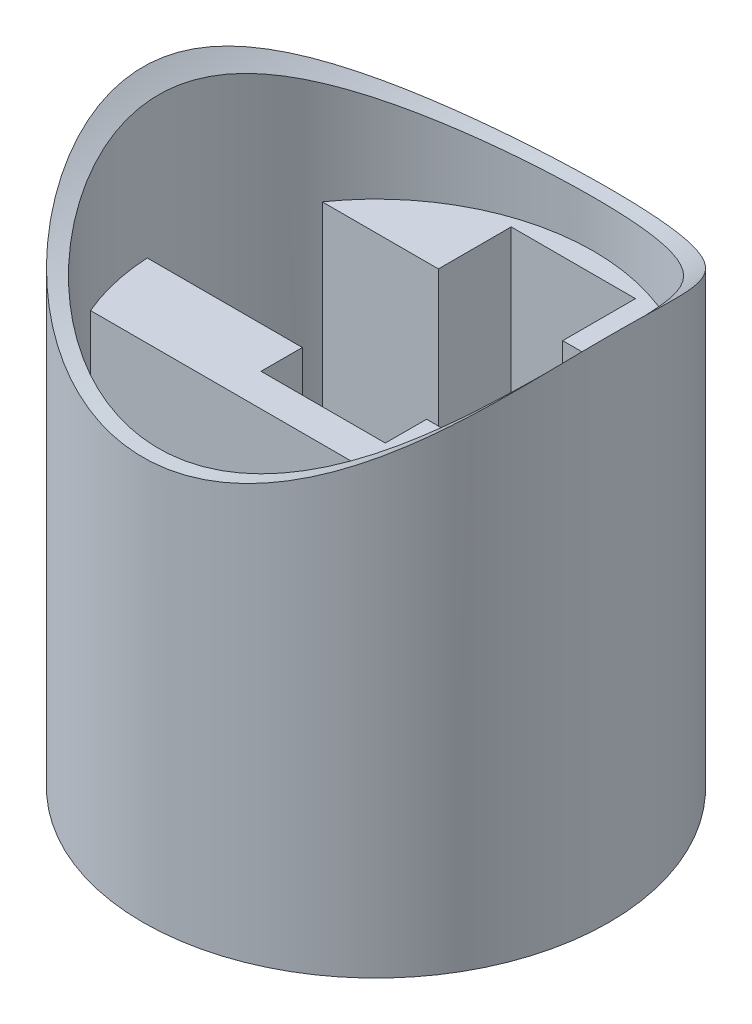
from build123d import *

# Parameters (mm, degrees)
SKETCH2_R               = 37.5
SKETCH2_R_2             = 35
BOSS_EXTRUDE2_DEPTH     = 37.3
BOSS_EXTRUDE3_START     = 20
SKETCH3_R               = 37.5
BOSS_EXTRUDE3_DEPTH     = 20
SKETCH4_R               = 37.5
SKETCH4_R_2             = 35
BOSS_EXTRUDE4_DEPTH     = 40
CUT_EXTRUDE2_DEPTH      = 60
CUT_EXTRUDE2_DEPTH_BACK = 60
SKETCH5_R               = 50


with BuildPart() as part:
    # Sketch2 → Boss-Extrude2 (new body)
    # profile 1 of 3: a face of its own
    with BuildSketch(Plane(origin=(0, 0, 0), x_dir=(1, 0, 0), z_dir=(0, 1, 0))):
        with Locations(Location((0, 0, 0), (0, 0, 270))):
            Circle(SKETCH2_R)
        Circle(SKETCH2_R_2, mode=Mode.SUBTRACT)
    # profile 2 of 3: a face of its own
    with BuildSketch(Plane(origin=(0, 0, 0), x_dir=(1, 0, 0), z_dir=(0, 1, 0))):
        with BuildLine():
            ThreePointArc((28.693735847, 20.041694617), (0, 35), (-28.693735847, 20.041694617))
            Line((-28.693735847, 20.041694617), (-10, 20.041694617))
            Line((-10, 20.041694617), (-10, 31.75))
            Line((-10, 31.75), (10, 31.75))
            Line((10, 31.75), (10, 20.041694617))
            Line((10, 20.041694617), (28.693735847, 20.041694617))
        make_face()
    # profile 3 of 3: a face of its own
    with BuildSketch(Plane(origin=(0, 0, 0), x_dir=(1, 0, 0), z_dir=(0, 1, 0))):
        with BuildLine():
            Line((-10, -1.861454278), (-34.950464775, -1.861454278))
            ThreePointArc((-34.950464775, -1.861454278), (-34.090270263, -7.928018251), (-32.18529571, -13.751608636))
            Line((-32.18529571, -13.751608636), (32.18529571, -13.751608636))
            ThreePointArc((32.18529571, -13.751608636), (34.090270263, -7.928018251), (34.950464775, -1.861454278))
            Line((34.950464775, -1.861454278), (10, -1.861454278))
            Line((10, -1.861454278), (10, -8.5))
            Line((10, -8.5), (-10, -8.5))
            Line((-10, -8.5), (-10, -1.861454278))
        make_face()
    extrude(amount=BOSS_EXTRUDE2_DEPTH)

    # Sketch3 → Boss-Extrude3 (add)
    with BuildSketch(Plane.XZ.offset(BOSS_EXTRUDE3_START)):
        with Locations(Location((0, 0, 0), (0, 0, 270))):
            Circle(SKETCH3_R)
    extrude(amount=-BOSS_EXTRUDE3_DEPTH)

    # Sketch4 → Boss-Extrude4 (add)
    with BuildSketch(Plane(origin=(0, 37.3, 0), x_dir=(1, 0, 0), z_dir=(0, 1, 0))):
        with Locations(Location((0, 0, 0), (0, 0, 90))):
            Circle(SKETCH4_R)
        with Locations(Location((0, 0, 0), (0, 0, 34.933118398))):
            Circle(SKETCH4_R_2, mode=Mode.SUBTRACT)
    extrude(amount=BOSS_EXTRUDE4_DEPTH)

    # Sketch5 → Cut-Extrude2 (cut, two sides: drawn at the far end of the back side and taken through both)
    with BuildSketch(Plane.XY.offset(-CUT_EXTRUDE2_DEPTH_BACK)):
        with Locations((0, 94.8)):
            Circle(SKETCH5_R)
    extrude(amount=CUT_EXTRUDE2_DEPTH + CUT_EXTRUDE2_DEPTH_BACK, mode=Mode.SUBTRACT)


solid = part.part
